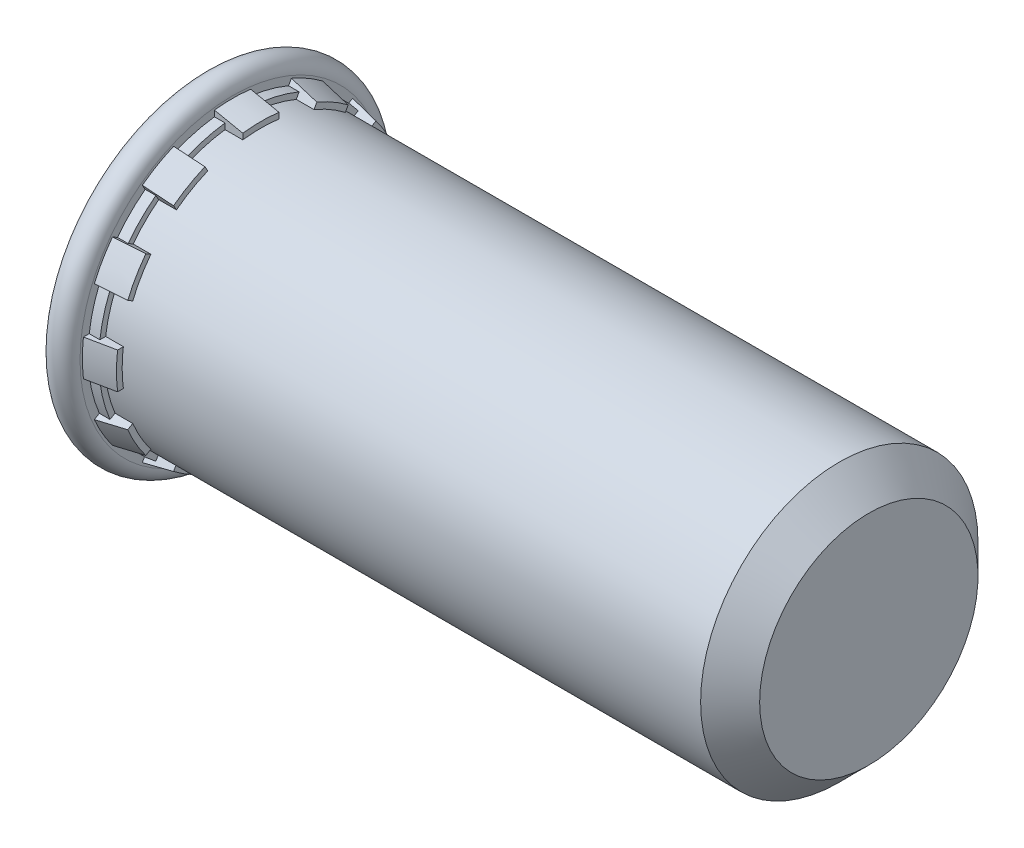
from build123d import *

# Parameters (mm, degrees)
RIBCUT1_DEPTH    = 0.508
RIBCUT2_DEPTH    = 0.8128
RIBCUTSPAT_COUNT = 12
RIBCUTSPAT_ANGLE = 330


with BuildPart() as part:
    # BodySke → BaseBody (revolve)
    with BuildSketch(Plane.XY, mode=Mode.PRIVATE) as basebody_sk:
        with BuildLine():
            Line((0, 0), (0, 4.36626))
            Line((0, 4.36626), (0.00508, 4.36626))
            Line((0.00508, 4.36626), (0.00508, 4.37134))
            ThreePointArc((0.00508, 4.37134), (0.40894, 4.7752), (0.8128, 4.37134))
            Line((0.8128, 4.37134), (0.8128, 4.3053))
            Line((0.8128, 4.3053), (1.6256, 4.1402))
            Line((1.6256, 4.1402), (1.6256, 3.9751))
            Line((1.6256, 3.9751), (18.20418, 3.9751))
            Line((18.20418, 3.9751), (19.05, 3.12928))
            Line((19.05, 3.12928), (19.05, 0))
            Line((19.05, 0), (0, 0))
        make_face()
    revolve(basebody_sk.sketch.rotate(Axis((0, 0, 0), (1, 0, 0)), 90), axis=Axis((0, 0, 0), (1, 0, 0)))

    # RibCut1Ske → RibCut1 (cut)
    with BuildSketch(Plane(origin=(1.6256, 0, 0), x_dir=(0, 0, -1), z_dir=(1, 0, 0))):
        with BuildLine():
            Line((0.518854667, 3.941092468), (0.518854667, 4.746927941))
            ThreePointArc((0.518854667, 4.746927941), (1.235912704, 4.612489006), (1.924122648, 4.37038752))
            Line((1.924122648, 4.37038752), (1.521204912, 3.67251353))
            ThreePointArc((1.521204912, 3.67251353), (1.028831586, 3.839651752), (0.518854667, 3.941092468))
        make_face()
    ribcut1 = extrude(amount=-RIBCUT1_DEPTH, mode=Mode.SUBTRACT)

    # RibCut2Ske → RibCut2 (cut)
    with BuildSketch(Plane(origin=(1.6256, 0, 0), x_dir=(0, 0, -1), z_dir=(1, 0, 0))):
        with BuildLine():
            Line((0.518854667, 4.107559601), (0.518854667, 4.746927941))
            ThreePointArc((0.518854667, 4.746927941), (1.235912704, 4.612489006), (1.924122648, 4.37038752))
            Line((1.924122648, 4.37038752), (1.604438478, 3.816678295))
            ThreePointArc((1.604438478, 3.816678295), (1.071562611, 3.999126106), (0.518854667, 4.107559601))
        make_face()
    ribcut2 = extrude(amount=-RIBCUT2_DEPTH, mode=Mode.SUBTRACT)

    # RibCutsPat: RibCut1, RibCut2 ×12 about axis
    ribcutspat_axis = Axis((0, 0, 0), (1, 0, 0))
    add([ribcut1.rotate(ribcutspat_axis, i * RIBCUTSPAT_ANGLE / (RIBCUTSPAT_COUNT - 1)) for i in range(1, RIBCUTSPAT_COUNT)], mode=Mode.SUBTRACT)
    add([ribcut2.rotate(ribcutspat_axis, i * RIBCUTSPAT_ANGLE / (RIBCUTSPAT_COUNT - 1)) for i in range(1, RIBCUTSPAT_COUNT)], mode=Mode.SUBTRACT)


solid = part.part
